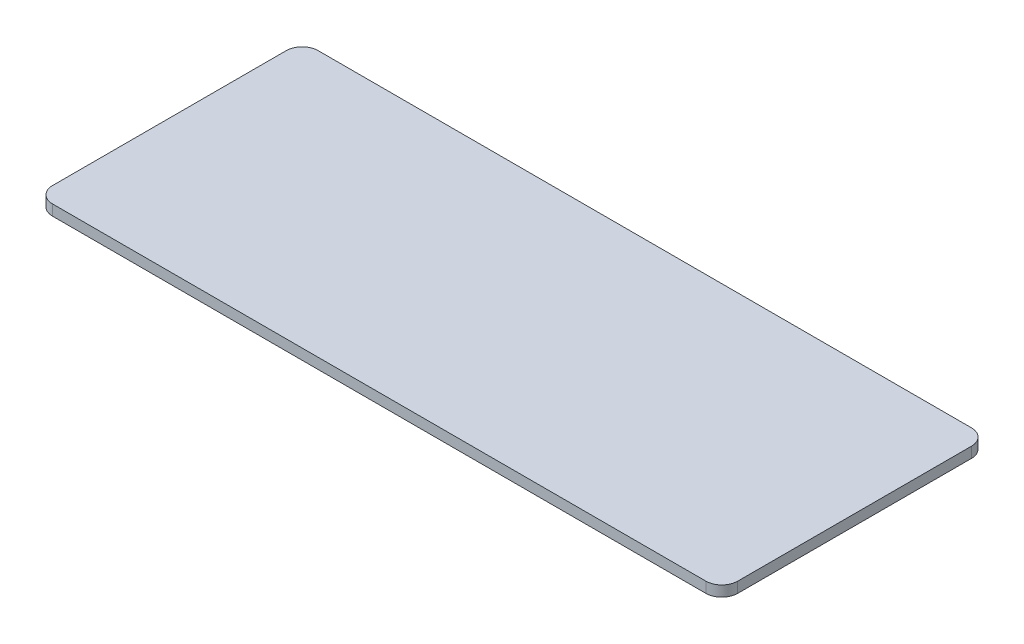
from build123d import *

# Parameters (mm, degrees)
SKETCH1_W           = 129
SKETCH1_H           = 50
BOSS_EXTRUDE1_DEPTH = 2
FILLET1_R           = 3


with BuildPart() as part:
    # Sketch1 → Boss-Extrude1 (new body)
    with BuildSketch(Plane(origin=(0, 0, 0), x_dir=(1, 0, 0), z_dir=(0, 1, 0))):
        Rectangle(SKETCH1_W, SKETCH1_H)
    extrude(amount=BOSS_EXTRUDE1_DEPTH)

    # Fillet1
    fillet1_edges = [part.edges().sort_by_distance(p)[0] for p in [
        (64.5, 1, 25),
        (-64.5, 1, 25),
        (-64.5, 1, -25),
        (64.5, 1, -25),
    ]]
    fillet(fillet1_edges, radius=FILLET1_R)


solid = part.part
